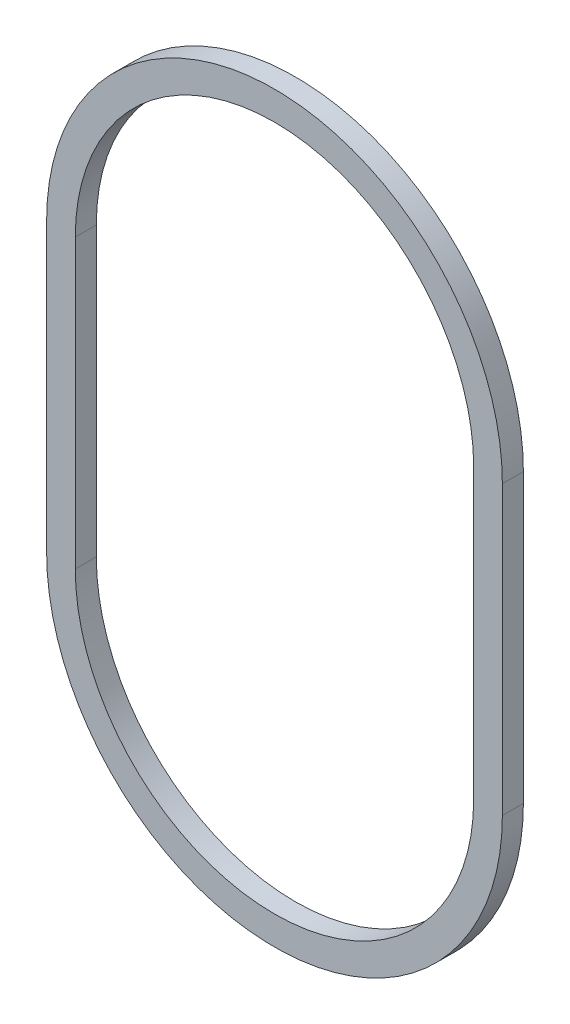
from build123d import *

# Parameters (mm, degrees)
Y_KSEKLIK_EKSTR_ZYON1_DEPTH = 1.1


with BuildPart() as part:
    # Çizim1 → Yükseklik-Ekstrüzyon1 (new, symmetric)
    with BuildSketch(Plane.XY):
        with BuildLine():
            Line((23.85, -15.04), (23.85, 15.04))
            ThreePointArc((23.85, 15.04), (0, 38.89), (-23.85, 15.04))
            Line((-23.85, 15.04), (-23.85, -15.04))
            ThreePointArc((-23.85, -15.04), (0, -38.89), (23.85, -15.04))
        make_face()
        with BuildLine():
            Line((-20.85, 15.04), (-20.85, -15.04))
            ThreePointArc((-20.85, -15.04), (0, -35.89), (20.85, -15.04))
            Line((20.85, -15.04), (20.85, 15.04))
            ThreePointArc((20.85, 15.04), (0, 35.89), (-20.85, 15.04))
        make_face(mode=Mode.SUBTRACT)
    extrude(amount=Y_KSEKLIK_EKSTR_ZYON1_DEPTH, both=True)


solid = part.part
